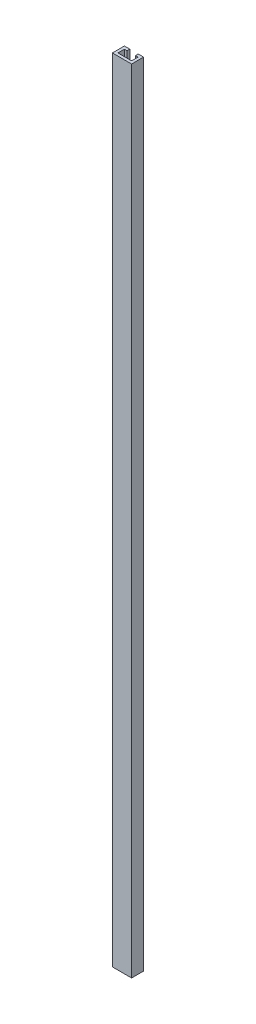
from build123d import *

# Parameters (mm, degrees)
EXTRUDE_1_DEPTH = 330


with BuildPart() as part:
    # 草图1 → 凸台-拉伸1 (new body)
    with BuildSketch(Plane(origin=(0, 0, 0), x_dir=(1, 0, 0), z_dir=(0, 1, 0))):
        Polygon((0, -5), (8, -5), (8, 0), (5.75, 0), (5.75, -1.15), (6.85, -1.15), (6.85, -3.85), (1.15, -3.85), (1.15, -1.15), (2.25, -1.15), (2.25, 0), (0, 0), align=None)
    extrude(amount=EXTRUDE_1_DEPTH)


solid = part.part
